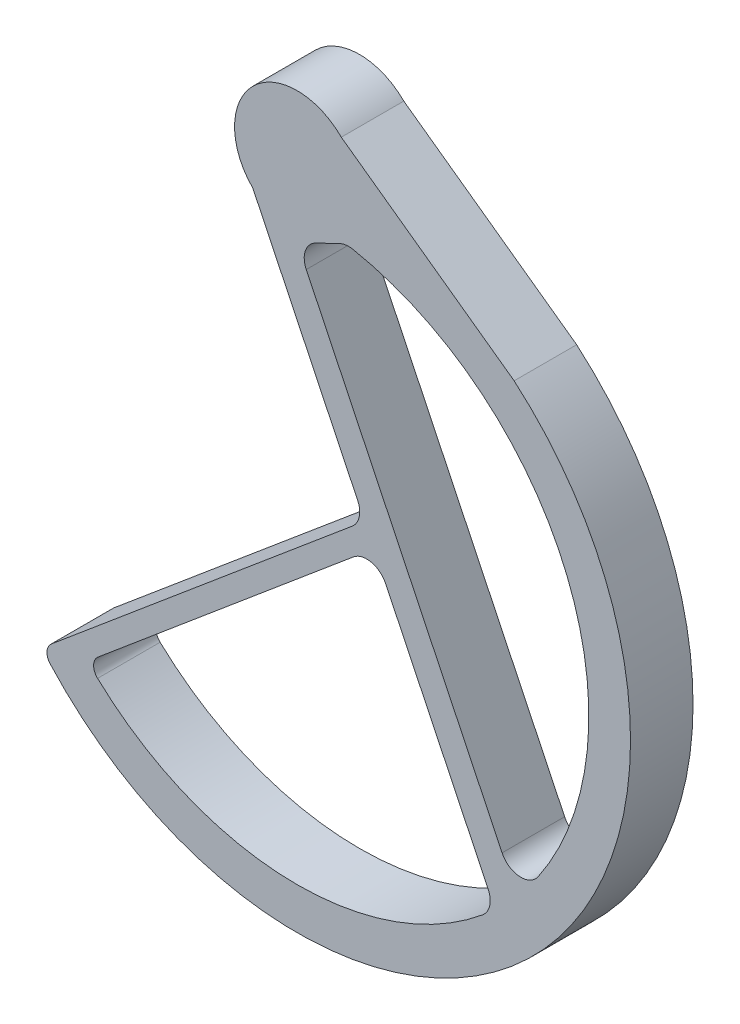
from build123d import *

# Parameters (mm, degrees)
EXTRUDE_1_DEPTH     = 15
CUT_EXTRUDE_START   = -15
CUT_EXTRUDE_1_DEPTH = 15
SKETCH_8_R          = 10.1
CUT_EXTRUDE_3_DEPTH = 2


with BuildPart() as part:
    # ｽｹｯﾁ4 → ﾎﾞｽ - 押し出し1 (new body)
    with BuildSketch(Plane.XY):
        with BuildLine():
            Line((-53.623111018, -124.995132678), (-58.940636287, -129.45706617))
            ThreePointArc((-58.940636287, -129.45706617), (-60.005384698, -131.552012131), (-59.233530865, -133.771635843))
            ThreePointArc((-59.233530865, -133.771635843), (57.362306223, -135.763481103), (52.076178918, -19.270504783))
            Line((52.076178918, -19.270504783), (10.606601718, 10.606601718))
            ThreePointArc((10.606601718, 10.606601718), (-10.606601718, 10.606601718), (-10.606601718, -10.606601718))
            Line((-10.606601718, -10.606601718), (14.536280154, -62.889638219))
            ThreePointArc((14.536280154, -62.889638219), (14.918089499, -66.109676181), (13.244185189, -68.886809092))
            Line((13.244185189, -68.886809092), (-53.623111018, -124.995132678))
        make_face()
        with BuildLine():
            Line((21.232400696, -76.813798404), (45.844843506, -127.993820346))
            ThreePointArc((45.844843506, -127.993820346), (46.221944165, -131.235480845), (44.518718993, -134.019289696))
            ThreePointArc((44.518718993, -134.019289696), (-2.231208213, -149.964431749), (-47.870174388, -131.072951785))
            ThreePointArc((-47.870174388, -131.072951785), (-48.817477846, -128.802229421), (-47.747678417, -126.586582094))
            Line((-47.747678417, -126.586582094), (13.511229465, -75.151532228))
            ThreePointArc((13.511229465, -75.151532228), (17.77869109, -74.092739753), (21.232400696, -76.813798404))
        make_face(mode=Mode.SUBTRACT)
    extrude(amount=EXTRUDE_1_DEPTH)

    # ｽｹｯﾁ6 → ｶｯﾄ - 押し出し1 (cut)
    with BuildSketch(Plane.XY.offset(15).offset(CUT_EXTRUDE_START)):
        with BuildLine():
            Line((49.189589797, -118.797265215), (2.201751786, -21.089020696))
            ThreePointArc((2.201751786, -21.089020696), (1.989274209, -17.268089629), (4.540836142, -14.416039025))
            Line((4.540836142, -14.416039025), (6.483415605, -13.48185369))
            Line((6.483415605, -13.48185369), (10.219658847, -11.685096486))
            ThreePointArc((10.219658847, -11.685096486), (11.747077013, -11.232198087), (13.339423466, -11.282754846))
            ThreePointArc((13.339423466, -11.282754846), (64.738421392, -53.37413296), (57.826055334, -119.448033215))
            ThreePointArc((57.826055334, -119.448033215), (53.319931874, -121.616182211), (49.189589797, -118.797265215))
        make_face()
    extrude(amount=CUT_EXTRUDE_1_DEPTH, mode=Mode.SUBTRACT)

    # ｽｹｯﾁ8 → ｶｯﾄ - 押し出し3 (cut)
    with BuildSketch(Plane(origin=(0, 0, 0), x_dir=(-1, 0, 0), z_dir=(0, 0, -1))):
        Circle(SKETCH_8_R)
    extrude(amount=-CUT_EXTRUDE_3_DEPTH, mode=Mode.SUBTRACT)


solid = part.part
